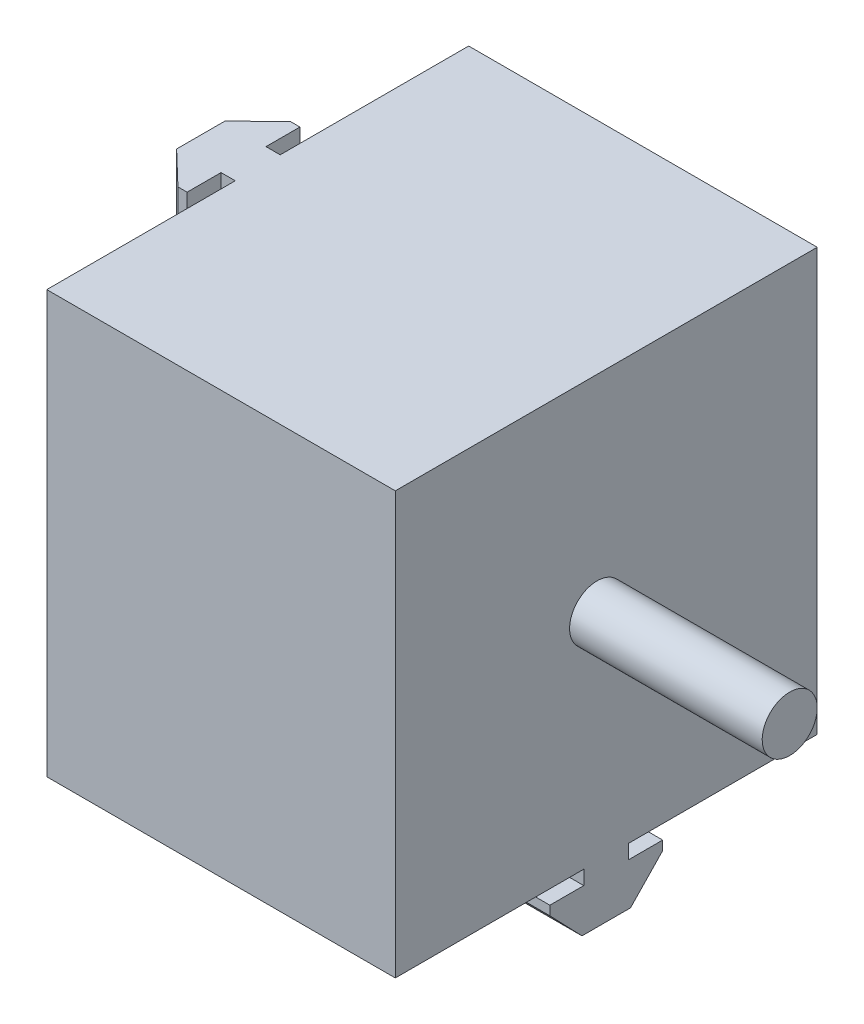
from build123d import *

# Parameters (mm, degrees)
ESQUISSE1_W                  = 44.2
ESQUISSE1_H                  = 52.2
BOSS_EXTRU_1_DEPTH           = 52.2
ENL_V_MAT_EXTRU_2_DEPTH      = 74.209903702
ENL_V_MAT_EXTRU_2_DEPTH_BACK = 44.2
ENL_V_MAT_EXTRU_3_DEPTH      = 74.209903702
ENL_V_MAT_EXTRU_3_DEPTH_BACK = 44.2
ENL_V_MAT_EXTRU_4_DEPTH      = 78.059003368
ENL_V_MAT_EXTRU_4_DEPTH_BACK = 46
ENL_V_MAT_EXTRU_5_DEPTH      = 78.059003368
ENL_V_MAT_EXTRU_5_DEPTH_BACK = 46
ENL_V_MAT_EXTRU_7_DEPTH      = 45.550224466
ENL_V_MAT_EXTRU_7_DEPTH_BACK = 45.550224466
ENL_V_MAT_EXTRU_8_DEPTH      = 78.059003368
ENL_V_MAT_EXTRU_8_DEPTH_BACK = 46
ENL_V_MAT_EXTRU_9_DEPTH      = 75.993733072
ENL_V_MAT_EXTRU_9_DEPTH_BACK = 46
ESQUISSE13_R                 = 3
BOSS_EXTRU_2_DEPTH           = 21


with BuildPart() as part:
    # Esquisse1 → Boss.-Extru.1 (new body)
    with BuildSketch(Plane.XY):
        Rectangle(ESQUISSE1_W, ESQUISSE1_H)
    extrude(amount=BOSS_EXTRU_1_DEPTH)

    # Esquisse2 → Enlèv. mat.-Extru.2 (cut, two sides: drawn at the far end of the back side and taken through both)
    with BuildSketch(Plane(origin=(22.1, 0, 0), x_dir=(0, 0, -1), z_dir=(1, 0, 0)).offset(-ENL_V_MAT_EXTRU_2_DEPTH_BACK)):
        Polygon((-201.352290675, -19.9), (-52.2, -19.9), (-28.55, -19.9), (-28.55, -21.45), (-32.25, -21.45), (-32.25, -22.45), (-28.745559959, -26.1), (74.553898465, -133.690091099), (-39.180744024, -409.461834307), (-315.086933163, -295.671743208), align=None)
    extrude(amount=ENL_V_MAT_EXTRU_2_DEPTH + ENL_V_MAT_EXTRU_2_DEPTH_BACK, mode=Mode.SUBTRACT)

    # Esquisse3 → Enlèv. mat.-Extru.3 (cut, two sides: drawn at the far end of the back side and taken through both)
    with BuildSketch(Plane(origin=(22.1, 0, 0), x_dir=(0, 0, -1), z_dir=(1, 0, 0)).offset(-ENL_V_MAT_EXTRU_3_DEPTH_BACK)):
        Polygon((149.152290675, -19.9), (0, -19.9), (-23.65, -19.9), (-23.65, -21.45), (-19.95, -21.45), (-19.95, -22.45), (-23.454440041, -26.1), (-126.753898465, -133.690091099), (-13.019255976, -409.461834307), (262.886933163, -295.671743208), align=None)
    extrude(amount=ENL_V_MAT_EXTRU_3_DEPTH + ENL_V_MAT_EXTRU_3_DEPTH_BACK, mode=Mode.SUBTRACT)

    # Esquisse4 → Enlèv. mat.-Extru.4 (cut, two sides: drawn at the far end of the back side and taken through both)
    with BuildSketch(Plane(origin=(0, 26.1, 0), x_dir=(1, 0, 0), z_dir=(0, 1, 0)).offset(-ENL_V_MAT_EXTRU_4_DEPTH_BACK)):
        Polygon((-15.9, -191.333109619), (-15.9, -52.2), (-15.9, -28.55), (-17.45, -28.55), (-17.45, -32.25), (-18.45, -32.25), (-22.1, -28.745559959), (-122.462816227, 67.614843274), (-379.791464965, -38.281593439), (-273.228648738, -297.229546332), align=None)
    extrude(amount=ENL_V_MAT_EXTRU_4_DEPTH + ENL_V_MAT_EXTRU_4_DEPTH_BACK, mode=Mode.SUBTRACT)

    # Esquisse5 → Enlèv. mat.-Extru.5 (cut, two sides: drawn at the far end of the back side and taken through both)
    with BuildSketch(Plane(origin=(0, 26.1, 0), x_dir=(1, 0, 0), z_dir=(0, 1, 0)).offset(-ENL_V_MAT_EXTRU_5_DEPTH_BACK)):
        Polygon((-15.9, 139.133109619), (-15.9, 0), (-15.9, -23.65), (-17.45, -23.65), (-17.45, -19.95), (-18.45, -19.95), (-22.1, -23.454440041), (-122.462816228, -119.814843274), (-379.791464965, -13.918406561), (-273.228648738, 245.029546332), align=None)
    extrude(amount=ENL_V_MAT_EXTRU_5_DEPTH + ENL_V_MAT_EXTRU_5_DEPTH_BACK, mode=Mode.SUBTRACT)

    # Esquisse6 → Enlèv. mat.-Extru.7 (cut, two sides: drawn at the far end of the back side and taken through both)
    with BuildSketch(Plane.XY.offset(28.55).offset(-ENL_V_MAT_EXTRU_7_DEPTH_BACK)):
        Polygon((-161.22284167, -19.9), (-22.1, -19.9), (-15.9, -19.9), (-15.9, -26.093649616), (-15.9, -165.216491285), (-212.645110561, -361.97019968), (-357.967952231, -216.653708395), align=None)
    extrude(amount=ENL_V_MAT_EXTRU_7_DEPTH + ENL_V_MAT_EXTRU_7_DEPTH_BACK, mode=Mode.SUBTRACT)

    # Esquisse11 → Enlèv. mat.-Extru.8 (cut, two sides: drawn at the far end of the back side and taken through both)
    with BuildSketch(Plane(origin=(0, 26.1, 0), x_dir=(1, 0, 0), z_dir=(0, 1, 0)).offset(-ENL_V_MAT_EXTRU_8_DEPTH_BACK)):
        Polygon((164.227968273, -49.1), (22.1, -49.1), (-15.9, -49.1), (-158.027968273, -49.1), (-158.027968273, -333.355936546), (164.227968273, -333.355936546), align=None)
    extrude(amount=ENL_V_MAT_EXTRU_8_DEPTH + ENL_V_MAT_EXTRU_8_DEPTH_BACK, mode=Mode.SUBTRACT)

    # Esquisse12 → Enlèv. mat.-Extru.9 (cut, two sides: drawn at the far end of the back side and taken through both)
    with BuildSketch(Plane(origin=(0, 26.1, 0), x_dir=(1, 0, 0), z_dir=(0, 1, 0)).offset(-ENL_V_MAT_EXTRU_9_DEPTH_BACK)):
        Polygon((159.687460199, -3.1), (22.1, -3.1), (-15.9, -3.1), (-153.487460199, -3.1), (-153.487460199, 272.074920398), (159.687460199, 272.074920398), align=None)
    extrude(amount=ENL_V_MAT_EXTRU_9_DEPTH + ENL_V_MAT_EXTRU_9_DEPTH_BACK, mode=Mode.SUBTRACT)

    # Esquisse13 → Boss.-Extru.2 (add)
    with BuildSketch(Plane(origin=(22.1, 0, 0), x_dir=(0, 0, -1), z_dir=(1, 0, 0))):
        with Locations(Location((-27.1, 3.6, 0), (0, 0, 270))):
            Circle(ESQUISSE13_R)
    extrude(amount=BOSS_EXTRU_2_DEPTH)


solid = part.part
